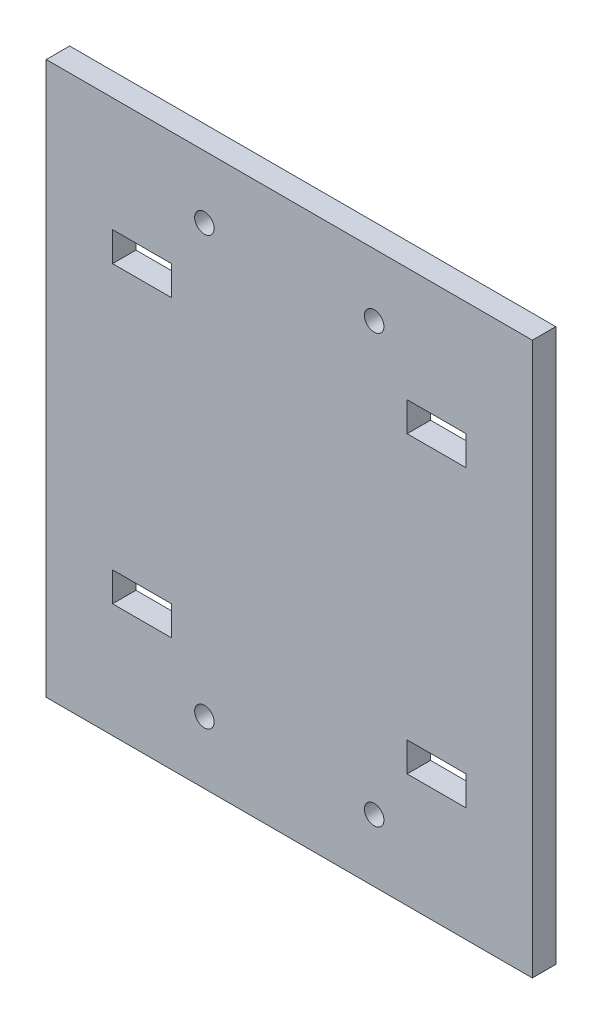
from build123d import *

# Parameters (mm, degrees)
SKETCH1_W           = 66
SKETCH1_H           = 75
BOSS_EXTRUDE1_DEPTH = 3.18
SKETCH2_R           = 1.325
SKETCH2_W           = 8
SKETCH2_H           = 4
CUT_EXTRUDE1_DEPTH  = 51.053595275


with BuildPart() as part:
    # Sketch1 → Boss-Extrude1 (new body)
    with BuildSketch(Plane.XY):
        Rectangle(SKETCH1_W, SKETCH1_H)
    extrude(amount=BOSS_EXTRUDE1_DEPTH)

    # Sketch2 → Cut-Extrude1 (cut, through all)
    with BuildSketch(Plane.XY.offset(3.18)):
        with Locations((-11.525, 29.025)):
            Circle(SKETCH2_R)
        with Locations((-11.525, -29.025)):
            Circle(SKETCH2_R)
        with Locations((11.525, -29.025)):
            Circle(SKETCH2_R)
        with Locations((11.525, 29.025)):
            Circle(SKETCH2_R)
        with Locations((-20, 20)):
            Rectangle(SKETCH2_W, SKETCH2_H)
        with Locations((-20, -20)):
            Rectangle(SKETCH2_W, SKETCH2_H)
        with Locations((20, -20)):
            Rectangle(SKETCH2_W, SKETCH2_H)
        with Locations((20, 20)):
            Rectangle(SKETCH2_W, SKETCH2_H)
    extrude(amount=-CUT_EXTRUDE1_DEPTH, mode=Mode.SUBTRACT)


solid = part.part
